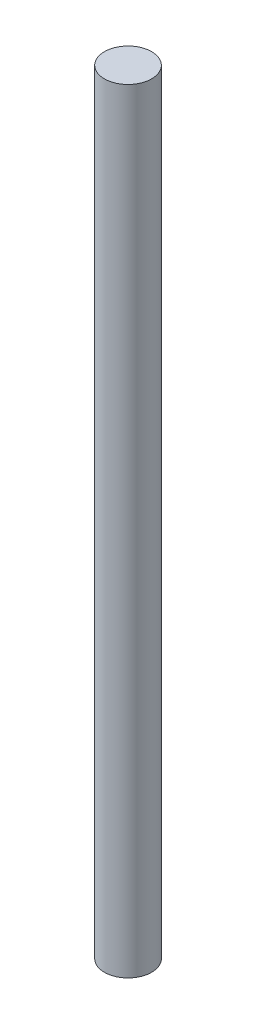
from build123d import *

# Parameters (mm, degrees)
SKETCH1_W = 2.5
SKETCH1_H = 82


with BuildPart() as part:
    # Sketch1 → Revolve1 (revolve)
    with BuildSketch(Plane.XY, mode=Mode.PRIVATE) as revolve1_sk:
        with Locations((1.25, -59)):
            Rectangle(SKETCH1_W, SKETCH1_H)
    revolve(revolve1_sk.sketch.rotate(Axis((0, -200, 0), (0, 1, 0)), 90), axis=Axis((0, -200, 0), (0, 1, 0)))


solid = part.part
